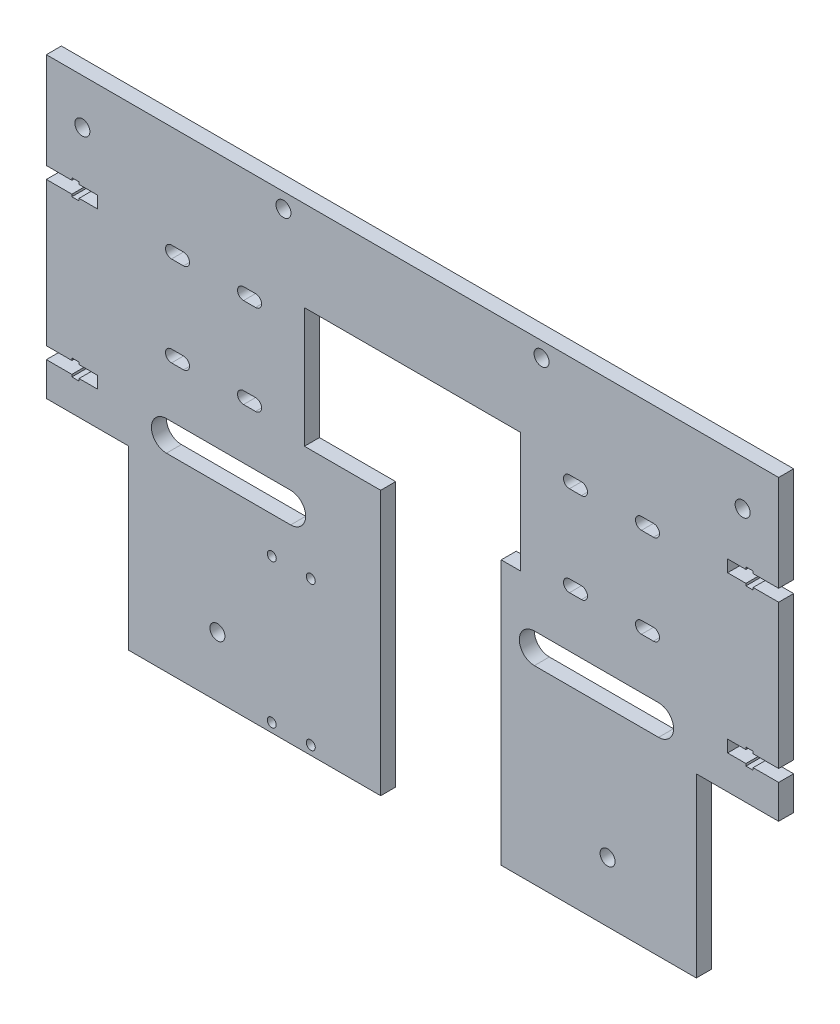
from build123d import *

# Parameters (mm, degrees)
SKETCH1_W           = 244
SKETCH1_H           = 158.154567899
BOSS_EXTRUDE1_DEPTH = 5
SKETCH7_W           = 27.420299367
SKETCH7_H           = 58.920830548
SKETCH7_W_2         = 72
SKETCH7_H_2         = 40
CUT_EXTRUDE3_DEPTH  = 10
SKETCH8_W           = 40.15918936
SKETCH8_H           = 88.154567899
CUT_EXTRUDE4_DEPTH  = 10
SKETCH9_R           = 2.5
CUT_EXTRUDE5_DEPTH  = 10
CUT_EXTRUDE6_DEPTH  = 10
SKETCH13_R          = 1.5
CUT_EXTRUDE8_DEPTH  = 10
CUT_EXTRUDE10_DEPTH = 10
CUT_EXTRUDE11_DEPTH = 10


with BuildPart() as part:
    # Sketch1 → Boss-Extrude1 (new body)
    with BuildSketch(Plane.XY):
        with Locations((-158.307962763, -36.858709382)):
            Rectangle(SKETCH1_W, SKETCH1_H)
    extrude(amount=BOSS_EXTRUDE1_DEPTH)

    # Sketch7 → Cut-Extrude3 (cut)
    with BuildSketch(Plane(origin=(0, 0, 0), x_dir=(-1, 0, 0), z_dir=(0, 0, -1))):
        with Locations((266.59781308, -86.475578057)):
            Rectangle(SKETCH7_W, SKETCH7_H)
        with Locations((50.018112446, -86.475578057)):
            Rectangle(SKETCH7_W, SKETCH7_H)
        with Locations((158.307962763, -7.781425432)):
            Rectangle(SKETCH7_W_2, SKETCH7_H_2)
    extrude(amount=-CUT_EXTRUDE3_DEPTH, mode=Mode.SUBTRACT)

    # Sketch8 → Cut-Extrude4 (cut)
    with BuildSketch(Plane.XY.offset(5)):
        with Locations((-148.828368083, -71.858709382)):
            Rectangle(SKETCH8_W, SKETCH8_H)
    extrude(amount=-CUT_EXTRUDE4_DEPTH, mode=Mode.SUBTRACT)

    # Sketch9 → Cut-Extrude5 (cut)
    with BuildSketch(Plane.XY.offset(5)):
        with Locations((-93.307962763, -95.935993331)):
            Circle(SKETCH9_R)
        with Locations((-223.307962763, -95.935993331)):
            Circle(SKETCH9_R)
        with Locations((-268.307962763, 27.218574568)):
            Circle(SKETCH9_R)
        with Locations((-48.307962763, 27.218574568)):
            Circle(SKETCH9_R)
        with Locations((-115.307962763, 37.218574568)):
            Circle(SKETCH9_R)
        with Locations((-201.307962763, 37.218574568)):
            Circle(SKETCH9_R)
    extrude(amount=-CUT_EXTRUDE5_DEPTH, mode=Mode.SUBTRACT)

    # Sketch10 → Cut-Extrude6 (cut)
    with BuildSketch(Plane.XY.offset(5)):
        Polygon((-271.807962763, 10.218574568), (-280.307962763, 10.218574568), (-280.307962763, 6.218574568), (-271.807962763, 6.218574568), (-271.807962763, 5.466366238), (-269.407962763, 5.466366238), (-269.407962763, 6.218574568), (-263.307962763, 6.218574568), (-263.307962763, 10.218574568), (-269.407962763, 10.218574568), (-269.407962763, 10.968574568), (-271.807962763, 10.968574568), align=None)
        Polygon((-271.807962763, -41.781425432), (-280.307962763, -41.781425432), (-280.307962763, -45.781425432), (-271.807962763, -45.781425432), (-271.807962763, -46.531425432), (-269.407962763, -46.531425432), (-269.407962763, -45.781425432), (-263.307962763, -45.781425432), (-263.307962763, -41.781425432), (-269.407962763, -41.781425432), (-269.407962763, -41.029217101), (-271.807962763, -41.029217101), align=None)
        Polygon((-53.307962763, -41.781425432), (-53.307962763, -45.781425432), (-47.207962763, -45.781425432), (-47.207962763, -46.531425432), (-44.807962763, -46.531425432), (-44.807962763, -45.781425432), (-36.307962763, -45.781425432), (-36.307962763, -41.781425432), (-44.807962763, -41.781425432), (-44.807962763, -41.029217101), (-47.207962763, -41.029217101), (-47.207962763, -41.781425432), align=None)
        Polygon((-44.807962763, 6.218574568), (-36.307962763, 6.218574568), (-36.307962763, 10.218574568), (-44.807962763, 10.218574568), (-44.807962763, 10.968574568), (-47.207962763, 10.968574568), (-47.207962763, 10.218574568), (-53.307962763, 10.218574568), (-53.307962763, 6.218574568), (-47.207962763, 6.218574568), (-47.207962763, 5.466366238), (-44.807962763, 5.466366238), align=None)
    extrude(amount=-CUT_EXTRUDE6_DEPTH, mode=Mode.SUBTRACT)

    # Sketch13 → Cut-Extrude8 (cut)
    with BuildSketch(Plane.XY.offset(5)):
        with Locations((-205.205391913, -112.935993331)):
            Circle(SKETCH13_R)
        with Locations((-205.205391913, -64.935993331)):
            Circle(SKETCH13_R)
        with Locations((-192.205391913, -112.935993331)):
            Circle(SKETCH13_R)
        with Locations((-192.205391913, -64.935993331)):
            Circle(SKETCH13_R)
    extrude(amount=-CUT_EXTRUDE8_DEPTH, mode=Mode.SUBTRACT)

    # Sketch15 → Cut-Extrude10 (cut)
    with BuildSketch(Plane.XY.offset(5)):
        with BuildLine():
            Line((-198.907962763, -42.781425432), (-240.307962763, -42.781425432))
            ThreePointArc((-240.307962763, -42.781425432), (-245.307962763, -47.781425432), (-240.307962763, -52.781425432))
            Line((-240.307962763, -52.781425432), (-198.907962763, -52.781425432))
            ThreePointArc((-198.907962763, -52.781425432), (-193.907962763, -47.781425432), (-198.907962763, -42.781425432))
        make_face()
        with BuildLine():
            Line((-117.707962763, -42.781425432), (-76.307962763, -42.781425432))
            ThreePointArc((-76.307962763, -42.781425432), (-71.307962763, -47.781425432), (-76.307962763, -52.781425432))
            Line((-76.307962763, -52.781425432), (-117.707962763, -52.781425432))
            ThreePointArc((-117.707962763, -52.781425432), (-122.707962763, -47.781425432), (-117.707962763, -42.781425432))
        make_face()
    extrude(amount=-CUT_EXTRUDE10_DEPTH, mode=Mode.SUBTRACT)

    # Sketch16 → Cut-Extrude11 (cut)
    with BuildSketch(Plane.XY.offset(5)):
        with BuildLine():
            Line((-212.607962763, -25.881425432), (-210.607962763, -25.881425432))
            ThreePointArc((-210.607962763, -25.881425432), (-208.607962763, -23.881425432), (-210.607962763, -21.881425432))
            Line((-210.607962763, -21.881425432), (-214.607962763, -21.881425432))
            ThreePointArc((-214.607962763, -21.881425432), (-216.607962763, -23.881425432), (-214.607962763, -25.881425432))
            Line((-214.607962763, -25.881425432), (-212.607962763, -25.881425432))
        make_face()
        with BuildLine():
            Line((-236.607962763, -25.881425432), (-234.607962763, -25.881425432))
            ThreePointArc((-234.607962763, -25.881425432), (-232.607962763, -23.881425432), (-234.607962763, -21.881425432))
            Line((-234.607962763, -21.881425432), (-238.607962763, -21.881425432))
            ThreePointArc((-238.607962763, -21.881425432), (-240.607962763, -23.881425432), (-238.607962763, -25.881425432))
            Line((-238.607962763, -25.881425432), (-236.607962763, -25.881425432))
        make_face()
        with BuildLine():
            Line((-212.607962763, 4.118574568), (-210.607962763, 4.118574568))
            ThreePointArc((-210.607962763, 4.118574568), (-208.607962763, 6.118574568), (-210.607962763, 8.118574568))
            Line((-210.607962763, 8.118574568), (-212.607962763, 8.118574568))
            Line((-212.607962763, 8.118574568), (-214.607962763, 8.118574568))
            ThreePointArc((-214.607962763, 8.118574568), (-216.607962763, 6.118574568), (-214.607962763, 4.118574568))
            Line((-214.607962763, 4.118574568), (-212.607962763, 4.118574568))
        make_face()
        with BuildLine():
            Line((-236.607962763, 4.118574568), (-234.607962763, 4.118574568))
            ThreePointArc((-234.607962763, 4.118574568), (-232.607962763, 6.118574568), (-234.607962763, 8.118574568))
            Line((-234.607962763, 8.118574568), (-238.607962763, 8.118574568))
            ThreePointArc((-238.607962763, 8.118574568), (-240.607962763, 6.118574568), (-238.607962763, 4.118574568))
            Line((-238.607962763, 4.118574568), (-236.607962763, 4.118574568))
        make_face()
        with BuildLine():
            Line((-78.007962763, 4.118574568), (-80.007962763, 4.118574568))
            Line((-80.007962763, 4.118574568), (-82.007962763, 4.118574568))
            ThreePointArc((-82.007962763, 4.118574568), (-84.007962763, 6.118574568), (-82.007962763, 8.118574568))
            Line((-82.007962763, 8.118574568), (-78.007962763, 8.118574568))
            ThreePointArc((-78.007962763, 8.118574568), (-76.007962763, 6.118574568), (-78.007962763, 4.118574568))
        make_face()
        with BuildLine():
            Line((-78.007962763, -25.881425432), (-80.007962763, -25.881425432))
            Line((-80.007962763, -25.881425432), (-82.007962763, -25.881425432))
            ThreePointArc((-82.007962763, -25.881425432), (-84.007962763, -23.881425432), (-82.007962763, -21.881425432))
            Line((-82.007962763, -21.881425432), (-78.007962763, -21.881425432))
            ThreePointArc((-78.007962763, -21.881425432), (-76.007962763, -23.881425432), (-78.007962763, -25.881425432))
        make_face()
        with BuildLine():
            Line((-102.007962763, 8.118574568), (-104.007962763, 8.118574568))
            Line((-104.007962763, 8.118574568), (-106.007962763, 8.118574568))
            ThreePointArc((-106.007962763, 8.118574568), (-108.007962763, 6.118574568), (-106.007962763, 4.118574568))
            Line((-106.007962763, 4.118574568), (-104.007962763, 4.118574568))
            Line((-104.007962763, 4.118574568), (-102.007962763, 4.118574568))
            ThreePointArc((-102.007962763, 4.118574568), (-100.007962763, 6.118574568), (-102.007962763, 8.118574568))
        make_face()
        with BuildLine():
            Line((-102.007962763, -25.881425432), (-104.007962763, -25.881425432))
            Line((-104.007962763, -25.881425432), (-106.007962763, -25.881425432))
            ThreePointArc((-106.007962763, -25.881425432), (-108.007962763, -23.881425432), (-106.007962763, -21.881425432))
            Line((-106.007962763, -21.881425432), (-102.007962763, -21.881425432))
            ThreePointArc((-102.007962763, -21.881425432), (-100.007962763, -23.881425432), (-102.007962763, -25.881425432))
        make_face()
    extrude(amount=-CUT_EXTRUDE11_DEPTH, mode=Mode.SUBTRACT)


solid = part.part
